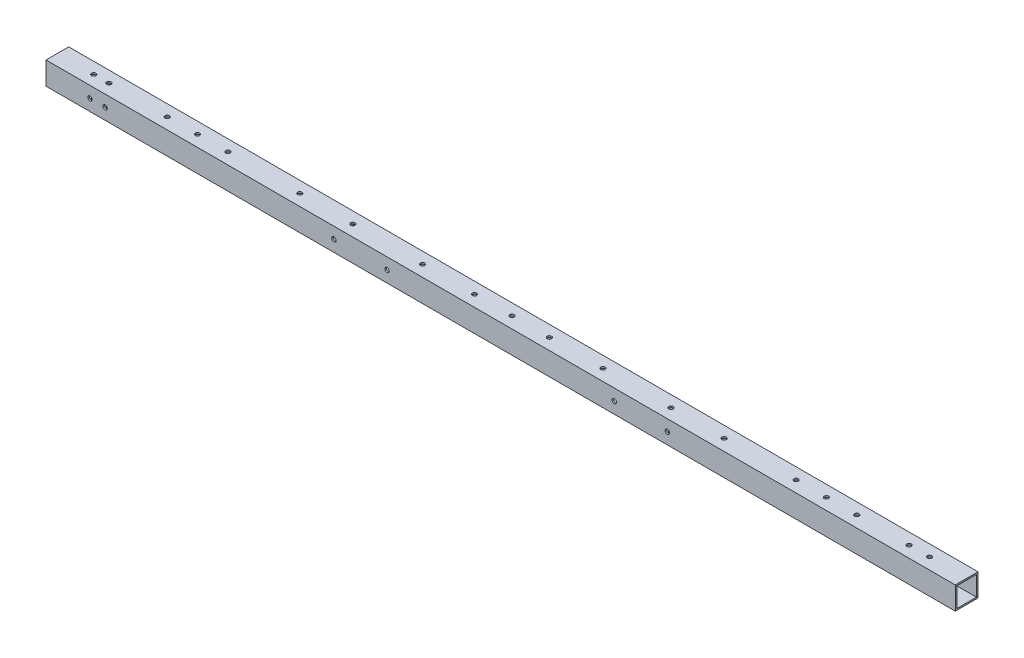
from build123d import *

# Parameters (mm, degrees)
SKETCH_1_W          = 15
SKETCH_1_H          = 15
SKETCH_1_W_2        = 13
SKETCH_1_H_2        = 13
EXTRUDE_1_DEPTH     = 600
SKETCH_2_R          = 1.45
CUT_EXTRUDE_1_DEPTH = 601.234329242
SKETCH_3_R          = 1.45
CUT_EXTRUDE_2_DEPTH = 601.234329242


with BuildPart() as part:
    # 草图1 → 凸台-拉伸1 (new body)
    with BuildSketch(Plane(origin=(0, 0, 0), x_dir=(0, 0, -1), z_dir=(1, 0, 0))):
        Rectangle(SKETCH_1_W, SKETCH_1_H)
        Rectangle(SKETCH_1_W_2, SKETCH_1_H_2, mode=Mode.SUBTRACT)
    extrude(amount=EXTRUDE_1_DEPTH)

    # 草图2 → 切除-拉伸1 (cut, through all)
    with BuildSketch(Plane(origin=(0, 7.5, 0), x_dir=(1, 0, 0), z_dir=(0, 1, 0))):
        with Locations(Location((487.5, 0, 0), (0, 0, 270))):
            Circle(SKETCH_2_R)
        with Locations(Location((507.5, 0, 0), (0, 0, 270))):
            Circle(SKETCH_2_R)
        with Locations(Location((527.5, 0, 0), (0, 0, 270))):
            Circle(SKETCH_2_R)
        with Locations(Location((72.5, 0, 0), (0, 0, 270))):
            Circle(SKETCH_2_R)
        with Locations(Location((92.5, 0, 0), (0, 0, 270))):
            Circle(SKETCH_2_R)
        with Locations(Location((112.5, 0, 0), (0, 0, 270))):
            Circle(SKETCH_2_R)
        with Locations(Location((34, 0, 0), (0, 0, 270))):
            Circle(SKETCH_2_R)
        with Locations(Location((160, 0, 0), (0, 0, 270))):
            Circle(SKETCH_2_R)
        with Locations(Location((195, 0, 0), (0, 0, 270))):
            Circle(SKETCH_2_R)
        with Locations(Location((275.3, 0, 0), (0, 0, 270))):
            Circle(SKETCH_2_R)
        with Locations(Location((300, 0, 0), (0, 0, 270))):
            Circle(SKETCH_2_R)
        with Locations(Location((324.7, 0, 0), (0, 0, 270))):
            Circle(SKETCH_2_R)
        with Locations(Location((405, 0, 0), (0, 0, 270))):
            Circle(SKETCH_2_R)
        with Locations(Location((440, 0, 0), (0, 0, 270))):
            Circle(SKETCH_2_R)
        with Locations(Location((562, 0, 0), (0, 0, 270))):
            Circle(SKETCH_2_R)
        with Locations(Location((575.5, 0, 0), (0, 0, 270))):
            Circle(SKETCH_2_R)
        with Locations(Location((24, 0, 0), (0, 0, 270))):
            Circle(SKETCH_2_R)
        with Locations(Location((360, 0, 0), (0, 0, 270))):
            Circle(SKETCH_2_R)
        with Locations(Location((241, 0, 0), (0, 0, 270))):
            Circle(SKETCH_2_R)
    extrude(amount=-CUT_EXTRUDE_1_DEPTH, mode=Mode.SUBTRACT)

    # 草图3 → 切除-拉伸2 (cut, through all)
    with BuildSketch(Plane(origin=(0, 0, -7.5), x_dir=(-1, 0, 0), z_dir=(0, 0, -1))):
        with Locations((-375, 0)):
            Circle(SKETCH_3_R)
        with Locations((-410, 0)):
            Circle(SKETCH_3_R)
        with Locations((-29, 0)):
            Circle(SKETCH_3_R)
        with Locations((-39, 0)):
            Circle(SKETCH_3_R)
        with Locations((-190, 0)):
            Circle(SKETCH_3_R)
        with Locations((-225, 0)):
            Circle(SKETCH_3_R)
    extrude(amount=-CUT_EXTRUDE_2_DEPTH, mode=Mode.SUBTRACT)


solid = part.part
